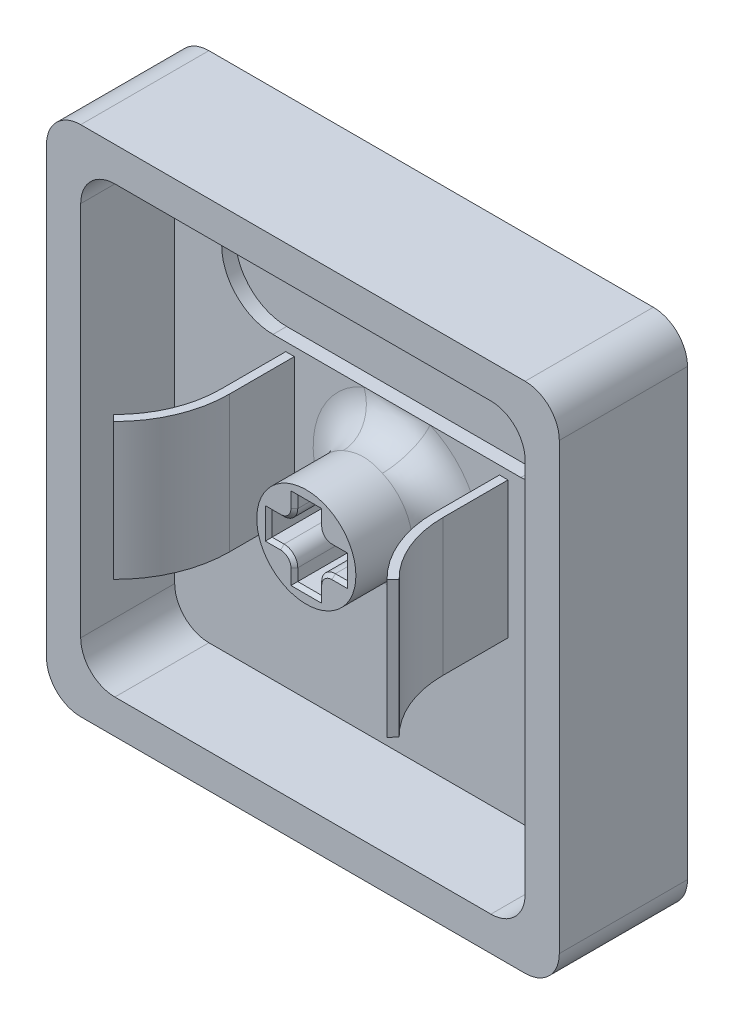
from build123d import *

# Parameters (mm, degrees)
EXTRUDE_1_DEPTH     = 5.5
SKETCH_1_6_R        = 2.9
EXTRUDE_2_DEPTH     = 5.3
EXTRUDE_START       = -2
EXTRUDE_3_DEPTH     = 2
EXTRUDE_4_DEPTH     = 2
CUT_EXTRUDE_1_REACH = 23.915
EXTRUDE_6_DEPTH     = 1.2
EXTRUDE_9_DEPTH     = 4
EXTRUDE_9_2_DEPTH   = 4
FILLET_4_R          = 0.8
CHAMFER_1_SIZE      = 0.2
FILLET_5_R          = 2


with BuildPart() as part:
    # 草图1 → 凸台-拉伸1 (new body)
    with BuildSketch(Plane.XY):
        with BuildLine():
            ThreePointArc((-15, 13), (-14.414213562, 14.414213562), (-13, 15))
            Line((-13, 15), (13, 15))
            ThreePointArc((13, 15), (14.414213562, 14.414213562), (15, 13))
            Line((15, 13), (15, -13))
            ThreePointArc((15, -13), (14.414213562, -14.414213562), (13, -15))
            Line((13, -15), (-13, -15))
            ThreePointArc((-13, -15), (-14.414213562, -14.414213562), (-15, -13))
            Line((-15, -13), (-15, 13))
        make_face()
        with BuildLine():
            ThreePointArc((-13, -11), (-12.414213562, -12.414213562), (-11, -13))
            Line((-11, -13), (11, -13))
            ThreePointArc((11, -13), (12.414213562, -12.414213562), (13, -11))
            Line((13, -11), (13, 11))
            ThreePointArc((13, 11), (12.414213562, 12.414213562), (11, 13))
            Line((11, 13), (-11, 13))
            ThreePointArc((-11, 13), (-12.414213562, 12.414213562), (-13, 11))
            Line((-13, 11), (-13, -11))
        make_face(mode=Mode.SUBTRACT)
    extrude(amount=EXTRUDE_1_DEPTH)



with BuildPart() as body_2:
    # 草图1<6> → 凸台-拉伸2 (new body)
    with BuildSketch(Plane.XY):
        Circle(SKETCH_1_6_R)
        Polygon((-2.2, -0.7), (-2.2, 0.7), (-0.7, 0.7), (-0.7, 2.2), (0.7, 2.2), (0.7, 0.7), (2.2, 0.7), (2.2, -0.7), (0.7, -0.7), (0.7, -2.2), (-0.7, -2.2), (-0.7, -0.7), align=None, mode=Mode.SUBTRACT)
    extrude(amount=EXTRUDE_2_DEPTH)


with BuildPart() as part_1:
    add(part.part)

    add(body_2.part)  # 凸台-拉伸3 merges body 2
    # 草图1<7> → 凸台-拉伸3 (add)
    with BuildSketch(Plane.XY.offset(EXTRUDE_START)):
        with BuildLine():
            Line((-13, 15), (13, 15))
            ThreePointArc((13, 15), (14.414213562, 14.414213562), (15, 13))
            Line((15, 13), (15, -13))
            ThreePointArc((15, -13), (14.414213562, -14.414213562), (13, -15))
            Line((13, -15), (-13, -15))
            ThreePointArc((-13, -15), (-14.414213562, -14.414213562), (-15, -13))
            Line((-15, -13), (-15, 13))
            ThreePointArc((-15, 13), (-14.414213562, 14.414213562), (-13, 15))
        make_face()
    extrude(amount=EXTRUDE_3_DEPTH)

    # 草图3 → 凸台-拉伸4 (add)
    with BuildSketch(Plane.XY):
        Polygon((0.7, 0.7), (0.7, 2.2), (-0.7, 2.2), (-0.7, 0.7), (-2.2, 0.7), (-2.2, -0.7), (-0.7, -0.7), (-0.7, -2.2), (0.7, -2.2), (0.7, -0.7), (2.2, -0.7), (2.2, 0.7), align=None)
    extrude(amount=EXTRUDE_4_DEPTH)

    # 草图5 → 切除-拉伸1 (cut, up to next)
    with BuildSketch(Plane.XY, mode=Mode.PRIVATE) as cut_extrude_1_sk1:
        with BuildLine():
            Line((7.25, 4.5), (-7.25, 4.5))
            ThreePointArc((-7.25, 4.5), (-10.25, 7.5), (-7.25, 10.5))
            Line((-7.25, 10.5), (7.25, 10.5))
            ThreePointArc((7.25, 10.5), (10.25, 7.5), (7.25, 4.5))
        make_face()
    cut_extrude_1_tool1 = extrude(cut_extrude_1_sk1.sketch, amount=-CUT_EXTRUDE_1_REACH, mode=Mode.PRIVATE) & part_1.part
    add(cut_extrude_1_tool1.solids().sort_by_distance((0, 7.5, 0))[0], mode=Mode.SUBTRACT)

    # 圆角4
    fillet_4_edges = [part_1.edges().sort_by_distance(p)[0] for p in [
        (0.7, 0.7, 3.65),
        (0.7, -0.7, 3.65),
        (-0.7, -0.7, 3.65),
        (-0.7, 0.7, 3.65),
    ]]
    fillet(fillet_4_edges, radius=FILLET_4_R)

    # 倒角1
    chamfer_1_edges = [part_1.edges().sort_by_distance(p)[0] for p in [
        (1.85, 0.7, 5.3),
        (1.85, -0.7, 5.3),
        (0.7, -1.85, 5.3),
        (-0.7, -1.85, 5.3),
        (0.934314575, -0.934314575, 5.3),
        (-0.934314575, -0.934314575, 5.3),
        (0.934314575, 0.934314575, 5.3),
        (-0.934314575, 0.934314575, 5.3),
        (0, -2.2, 5.3),
        (-1.85, -0.7, 5.3),
        (-2.2, 0, 5.3),
        (-0.7, 1.85, 5.3),
        (0, 2.2, 5.3),
        (0.7, 1.85, 5.3),
        (2.2, 0, 5.3),
        (-1.85, 0.7, 5.3),
    ]]
    chamfer(chamfer_1_edges, length=CHAMFER_1_SIZE)

    # 圆角5
    fillet_5_edges = [part_1.edges().sort_by_distance(p)[0] for p in [
        (-2.9, 0, 0),
    ]]
    fillet(fillet_5_edges, radius=FILLET_5_R)


with BuildPart() as body_2_2:
    # 草图6 → 凸台-拉伸6 (new body)
    with BuildSketch(Plane(origin=(0, 0, -2), x_dir=(-1, 0, 0), z_dir=(0, 0, -1))):
        with BuildLine():
            Line((7.25, 4.5), (-7.25, 4.5))
            ThreePointArc((-7.25, 4.5), (-10.25, 7.5), (-7.25, 10.5))
            Line((-7.25, 10.5), (7.25, 10.5))
            ThreePointArc((7.25, 10.5), (10.25, 7.5), (7.25, 4.5))
        make_face()
    extrude(amount=-EXTRUDE_6_DEPTH)


with BuildPart() as body_3:
    # 草图9 → 凸台-拉伸9 (new, symmetric)
    with BuildSketch(Plane(origin=(0, 0, 0), x_dir=(1, 0, 0), z_dir=(0, 1, 0))):
        with BuildLine():
            Line((8, -8.577982298), (8.350542857, -8.221443794))
            ThreePointArc((8.350542857, -8.221443794), (6.981348422, -6.200244031), (6.5, -3.806868679))
            Line((6.5, -3.806868679), (6.5, 1.163381533))
            Line((6.5, 1.163381533), (6, 1.163381533))
            Line((6, 1.163381533), (6, -3.806868679))
            ThreePointArc((6, -3.806868679), (6.52022402, -6.393542468), (8, -8.577982298))
        make_face()
    extrude(amount=EXTRUDE_9_DEPTH, both=True)


with BuildPart() as body_4:
    # 草图9 → Extrude 9 2 (new, symmetric)
    with BuildSketch(Plane(origin=(0, 0, 0), x_dir=(1, 0, 0), z_dir=(0, 1, 0))):
        with BuildLine():
            Line((-6, 1.163381533), (-6, -3.806868679))
            ThreePointArc((-6, -3.806868679), (-6.52022402, -6.393542468), (-8, -8.577982298))
            Line((-8, -8.577982298), (-8.350542857, -8.221443794))
            ThreePointArc((-8.350542857, -8.221443794), (-6.981348422, -6.200244031), (-6.5, -3.806868679))
            Line((-6.5, -3.806868679), (-6.5, 1.163381533))
            Line((-6.5, 1.163381533), (-6, 1.163381533))
        make_face()
    extrude(amount=EXTRUDE_9_2_DEPTH, both=True)


solid = Compound([part_1.part, body_2_2.part, body_3.part, body_4.part])
